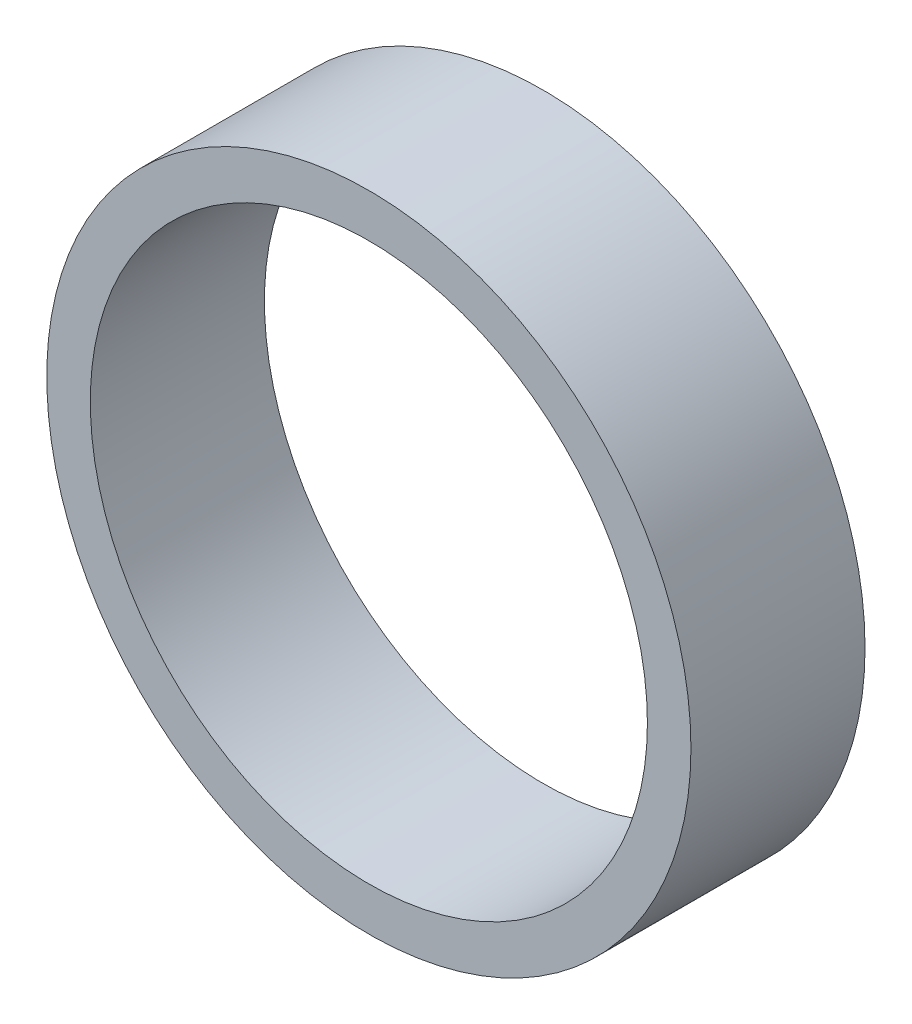
from build123d import *

# Parameters (mm, degrees)
SKETCH1_R           = 1.85
SKETCH1_R_2         = 1.6
BOSS_EXTRUDE1_DEPTH = 1


with BuildPart() as part:
    # Sketch1 → Boss-Extrude1 (new body)
    with BuildSketch(Plane.XY.offset(5)):
        with Locations((15, 0)):
            Circle(SKETCH1_R)
        with Locations((15, 0)):
            Circle(SKETCH1_R_2, mode=Mode.SUBTRACT)
    extrude(amount=BOSS_EXTRUDE1_DEPTH)


solid = part.part
